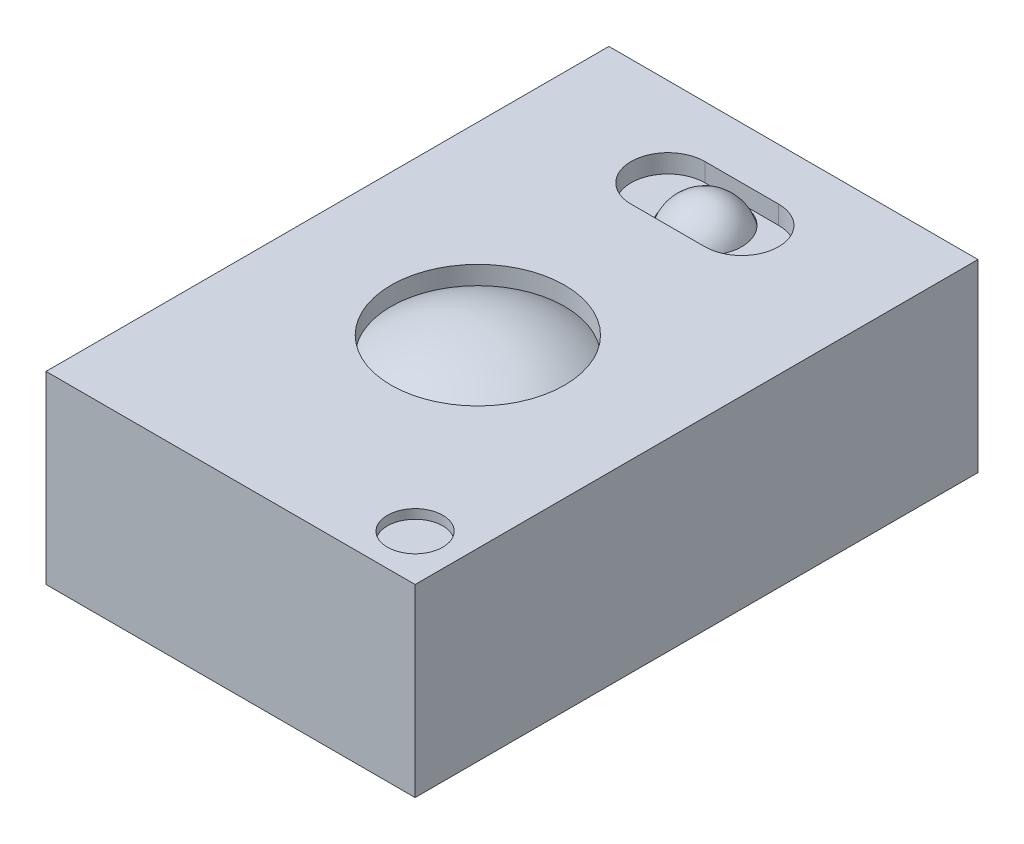
from build123d import *

# Parameters (mm, degrees)
SKETCH1_W           = 2
SKETCH1_H           = 3.05
BOSS_EXTRUDE1_DEPTH = 1
SKETCH2_R           = 0.47
CUT_EXTRUDE1_DEPTH  = 0.1
SKETCH3_R           = 0.15
CUT_EXTRUDE2_DEPTH  = 0.05
DOME1_FACE_RADIUS   = 0.47
DOME1_HEIGHT        = 0.15
SKETCH5_R           = 0.2
CUT_EXTRUDE3_DEPTH  = 0.01
DOME2_FACE_RADIUS   = 0.2
DOME2_HEIGHT        = 0.15
SKETCH6_W           = 0.5
SKETCH6_H           = 0.575
BOSS_EXTRUDE2_DEPTH = 0.01


with BuildPart() as part:
    # Sketch1 → Boss-Extrude1 (new body)
    with BuildSketch(Plane(origin=(0, 0, 0), x_dir=(1, 0, 0), z_dir=(0, 1, 0))):
        Rectangle(SKETCH1_W, SKETCH1_H)
    extrude(amount=BOSS_EXTRUDE1_DEPTH)

    # Sketch2 → Cut-Extrude1 (cut)
    with BuildSketch(Plane(origin=(0, 1, 0), x_dir=(1, 0, 0), z_dir=(0, 1, 0))):
        with Locations(Location((0, -0.185, 0), (0, 0, 270))):
            Circle(SKETCH2_R)
        with BuildLine():
            Line((-0.2, 1.245), (0.2, 1.245))
            ThreePointArc((0.2, 1.245), (0.4, 1.045), (0.2, 0.845))
            Line((0.2, 0.845), (-0.2, 0.845))
            ThreePointArc((-0.2, 0.845), (-0.4, 1.045), (-0.2, 1.245))
        make_face()
    extrude(amount=-CUT_EXTRUDE1_DEPTH, mode=Mode.SUBTRACT)

    # Sketch3 → Cut-Extrude2 (cut)
    with BuildSketch(Plane(origin=(0, 1, 0), x_dir=(1, 0, 0), z_dir=(0, 1, 0))):
        with Locations(Location((0.75, -1.275, 0), (0, 0, 270))):
            Circle(SKETCH3_R)
    extrude(amount=-CUT_EXTRUDE2_DEPTH, mode=Mode.SUBTRACT)

    # Dome1: a dome of height H over a round flat face of radius A is a cap of a sphere of radius (A * A + H * H) / (2 * H)
    dome1_r = (DOME1_FACE_RADIUS * DOME1_FACE_RADIUS + DOME1_HEIGHT * DOME1_HEIGHT) / (2 * DOME1_HEIGHT)
    dome1_base = Plane((0, 0.9, 0.185), z_dir=(0, 1, 0))
    with Locations(dome1_base.offset(DOME1_HEIGHT - dome1_r)):
        dome1_ball = Sphere(dome1_r, mode=Mode.PRIVATE)
    add(split(dome1_ball, bisect_by=dome1_base, keep=Keep.TOP, mode=Mode.PRIVATE))

    # Sketch5 → Cut-Extrude3 (cut)
    with BuildSketch(Plane(origin=(0, 0.9, 0), x_dir=(1, 0, 0), z_dir=(0, 1, 0))):
        with Locations(Location((0, 1.045, 0), (0, 0, 270))):
            Circle(SKETCH5_R)
    extrude(amount=-CUT_EXTRUDE3_DEPTH, mode=Mode.SUBTRACT)

    # Dome2: a dome of height H over a round flat face of radius A is a cap of a sphere of radius (A * A + H * H) / (2 * H)
    dome2_r = (DOME2_FACE_RADIUS * DOME2_FACE_RADIUS + DOME2_HEIGHT * DOME2_HEIGHT) / (2 * DOME2_HEIGHT)
    dome2_base = Plane((0, 0.89, -1.045), z_dir=(0, 1, 0))
    with Locations(dome2_base.offset(DOME2_HEIGHT - dome2_r)):
        dome2_ball = Sphere(dome2_r, mode=Mode.PRIVATE)
    add(split(dome2_ball, bisect_by=dome2_base, keep=Keep.TOP, mode=Mode.PRIVATE))

    # Sketch6 → Boss-Extrude2 (add)
    with BuildSketch(Plane.XZ):
        with Locations((0.675, -1.1625)):
            Rectangle(SKETCH6_W, SKETCH6_H)
        with Locations((0.675, -0.3825)):
            Rectangle(SKETCH6_W, SKETCH6_H)
        with Locations((0.675, 0.3975)):
            Rectangle(SKETCH6_W, SKETCH6_H)
        Polygon((0.925, 0.89), (0.925, 1.465), (0.425, 1.465), (0.425, 1.118326213), (0.635308002, 0.89), align=None)
        with Locations((-0.675, 1.1775)):
            Rectangle(SKETCH6_W, SKETCH6_H)
        with Locations((-0.675, 0.3975)):
            Rectangle(SKETCH6_W, SKETCH6_H)
        with Locations((-0.675, -0.3825)):
            Rectangle(SKETCH6_W, SKETCH6_H)
        with Locations((-0.675, -1.1625)):
            Rectangle(SKETCH6_W, SKETCH6_H)
    extrude(amount=BOSS_EXTRUDE2_DEPTH)


solid = part.part
